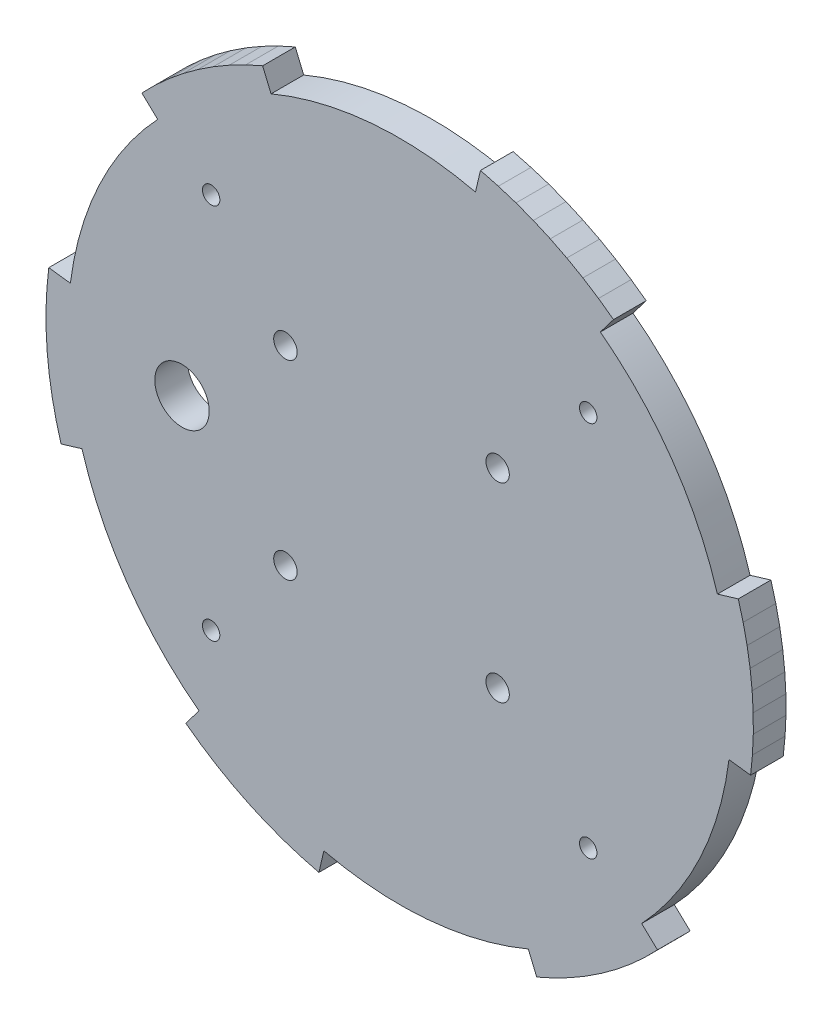
from build123d import *
from build123d.topology import SkipClean

# Parameters (mm, degrees)
SKETCH_1_R                = 61
SKETCH_1_R_2              = 1.6
SKETCH_1_R_3              = 2.15
SKETCH_1_R_4              = 5
EXTRUDE_1_DEPTH           = 6
EXTRUDE_2_DEPTH           = 6
SKETCH_3_R                = 5
EXTRUDE_3_DEPTH           = 6
SKETCH_4_R                = 5
REVOLVE_1_ANGLE           = 90
REVOLVE_1_OTHER_WAY_ANGLE = 90


with BuildPart() as part:
    # 草圖1 → 填料-伸長1 (new body)
    with BuildSketch(Plane.XY):
        Circle(SKETCH_1_R)
        with Locations((34.648232278, 34.648232278)):
            Circle(SKETCH_1_R_2, mode=Mode.SUBTRACT)
        with Locations((-34.648232278, 34.648232278)):
            Circle(SKETCH_1_R_2, mode=Mode.SUBTRACT)
        with Locations((-34.648232278, -34.648232278)):
            Circle(SKETCH_1_R_2, mode=Mode.SUBTRACT)
        with Locations((34.648232278, -34.648232278)):
            Circle(SKETCH_1_R_2, mode=Mode.SUBTRACT)
        with Locations((-21, 17.5)):
            Circle(SKETCH_1_R_3, mode=Mode.SUBTRACT)
        with Locations((-21, -17.5)):
            Circle(SKETCH_1_R_3, mode=Mode.SUBTRACT)
        with Locations((18, 17.5)):
            Circle(SKETCH_1_R_3, mode=Mode.SUBTRACT)
        with Locations((18, -17.5)):
            Circle(SKETCH_1_R_3, mode=Mode.SUBTRACT)
        with Locations((-40, 0)):
            Circle(SKETCH_1_R_4, mode=Mode.SUBTRACT)
    extrude(amount=EXTRUDE_1_DEPTH)

    # 草圖2 → 填料-伸長2 (add)
    with BuildSketch(Plane.XY):
        Polygon((64.487455585, -8.146660182), (64.82544102, -4.760482813), (64.985744426, -1.361257292), (64.967926424, 2.04169934), (64.772035851, 5.439059817), (64.398609631, 8.821512208), (63.848671297, 12.179785448), (63.123728194, 15.504674743), (62.22576734, 18.787066801), (57.917829601, 17.486423715), (58.753623935, 14.431274184), (59.428378669, 11.336569532), (59.940244349, 8.210792132), (60.287817985, 5.062509522), (60.470146902, 1.900350924), (60.48673135, -1.267016403), (60.337525872, -4.430910926), (60.02293943, -7.582660631), align=None)
        Polygon((39.298942466, 51.774444672), (36.53541956, 53.760237328), (33.671755609, 55.59867691), (30.715799716, 57.284724384), (27.675653952, 58.81375841), (24.559651143, 60.181588013), (21.376332038, 61.384464065), (18.134421893, 62.419089569), (14.842806557, 63.282628687), (13.815227642, 58.901523624), (16.878961915, 58.097767983), (19.896432128, 57.134770399), (22.859367603, 56.015170381), (25.75964714, 54.742036674), (28.589321275, 53.31885885), (31.340634067, 51.74953774), (34.00604436, 50.038374744), (36.578246449, 48.19006004), align=None)
        Polygon((-25.188513119, 59.921104853), (-28.290021459, 58.520720141), (-31.313988817, 56.959934203), (-34.252126707, 55.243025044), (-37.096381899, 53.374698594), (-39.838958487, 51.360075804), (-42.472339259, 49.204678617), (-44.989306302, 46.914414826), (-47.382960782, 44.495561885), (-44.102601959, 41.415099909), (-41.874662019, 43.6664938), (-39.531946541, 45.798200867), (-37.080876746, 47.804378249), (-34.528170845, 49.679527153), (-31.880825628, 51.418507926), (-29.146097283, 53.016554143), (-26.331481512, 54.46928567), (-23.44469298, 55.772720671), align=None)
        Polygon((-64.487455585, 8.146660182), (-64.82544102, 4.760482813), (-64.985744426, 1.361257292), (-64.967926424, -2.04169934), (-64.772035851, -5.439059817), (-64.398609631, -8.821512208), (-63.848671297, -12.179785448), (-63.123728194, -15.504674743), (-62.22576734, -18.787066801), (-57.917829601, -17.486423715), (-58.753623935, -14.431274184), (-59.428378669, -11.336569532), (-59.940244349, -8.210792132), (-60.287817985, -5.062509522), (-60.470146902, -1.900350924), (-60.48673135, 1.267016403), (-60.337525872, 4.430910926), (-60.02293943, 7.582660631), align=None)
        Polygon((-39.298942466, -51.774444672), (-36.53541956, -53.760237328), (-33.671755609, -55.59867691), (-30.715799716, -57.284724384), (-27.675653952, -58.81375841), (-24.559651143, -60.181588013), (-21.376332038, -61.384464065), (-18.134421893, -62.419089569), (-14.842806557, -63.282628687), (-13.815227642, -58.901523624), (-16.878961915, -58.097767983), (-19.896432128, -57.134770399), (-22.859367603, -56.015170381), (-25.75964714, -54.742036674), (-28.589321275, -53.31885885), (-31.340634067, -51.74953774), (-34.00604436, -50.038374744), (-36.578246449, -48.19006004), align=None)
        Polygon((25.188513119, -59.921104853), (28.290021459, -58.520720141), (31.313988817, -56.959934203), (34.252126707, -55.243025044), (37.096381899, -53.374698594), (39.838958487, -51.360075804), (42.472339259, -49.204678617), (44.989306302, -46.914414826), (47.382960782, -44.495561885), (44.102601959, -41.415099909), (41.874662019, -43.6664938), (39.531946541, -45.798200867), (37.080876746, -47.804378249), (34.528170845, -49.679527153), (31.880825628, -51.418507926), (29.146097283, -53.016554143), (26.331481512, -54.46928567), (23.44469298, -55.772720671), align=None)
    extrude(amount=EXTRUDE_2_DEPTH)

    # 草圖3 → 填料-伸長3 (add)
    with BuildSketch(Plane.XY):
        with Locations((0, 15)):
            Circle(SKETCH_3_R)
        with Locations((0, -15)):
            Circle(SKETCH_3_R)
    extrude(amount=-EXTRUDE_3_DEPTH)

    # 草圖4 → 旋轉1 (revolve)
    with BuildSketch(Plane(origin=(0, 0, 0), x_dir=(1, 0, 0), z_dir=(0, 1, 0))):
        with Locations((0, 21)):
            Circle(SKETCH_4_R)
    revolve(axis=Axis((-20, 0, -6), (1, 0, 0)), revolution_arc=REVOLVE_1_ANGLE)

    # 草圖4 → 旋轉1 other way (revolve)
    with SkipClean():  # the faces are left unmerged after this step: merging them gives an invalid solid
        with BuildSketch(Plane(origin=(0, 0, 0), x_dir=(1, 0, 0), z_dir=(0, 1, 0))):
            with Locations((0, 21)):
                Circle(SKETCH_4_R)
        revolve(axis=Axis((-20, 0, -6), (-1, 0, 0)), revolution_arc=REVOLVE_1_OTHER_WAY_ANGLE)


solid = part.part
